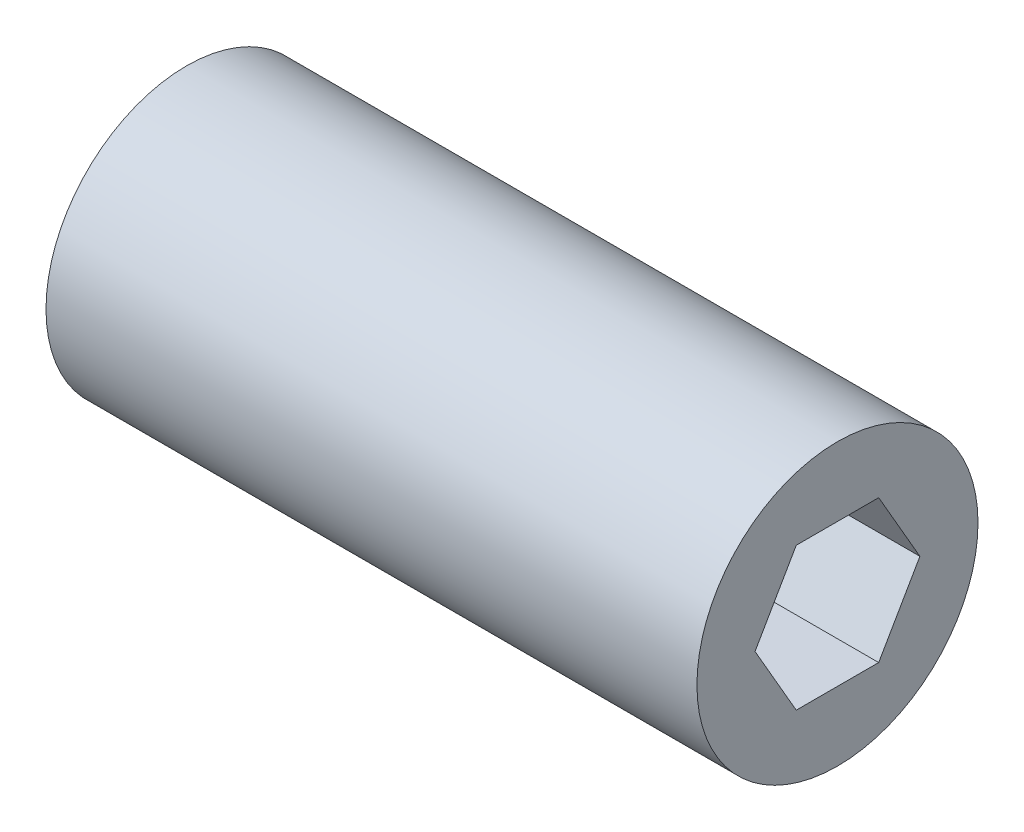
from build123d import *

# Parameters (mm, degrees)
CROQUIS1_R              = 12.5
SALIENTE_EXTRUIR1_DEPTH = 57.9


with BuildPart() as part:
    # Croquis1 → Saliente-Extruir1 (new body)
    with BuildSketch(Plane(origin=(0, 0, 0), x_dir=(0, 0, -1), z_dir=(1, 0, 0))):
        with Locations(Location((0, 0, 0), (0, 0, 180))):
            Circle(CROQUIS1_R)
        Polygon((7.332348419, 0), (3.666174209, 6.35), (-3.666174209, 6.35), (-7.332348419, 0), (-3.666174209, -6.35), (3.666174209, -6.35), align=None, mode=Mode.SUBTRACT)
    extrude(amount=SALIENTE_EXTRUIR1_DEPTH)


solid = part.part
